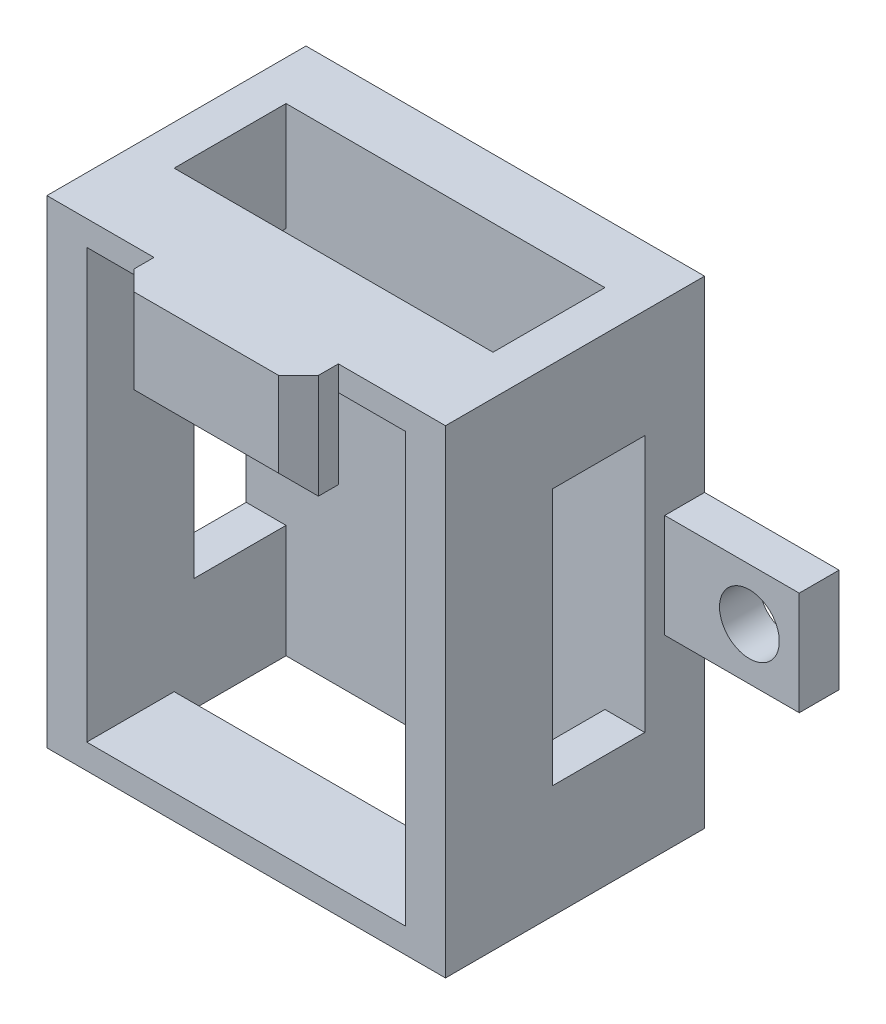
from build123d import *

# Parameters (mm, degrees)
SKETCH1_W           = 20
SKETCH1_H           = 24
BOSS_EXTRUDE1_DEPTH = 3
SKETCH2_W           = 20
SKETCH2_H           = 24
SKETCH2_W_2         = 16
SKETCH2_H_2         = 21.5
BOSS_EXTRUDE2_DEPTH = 10
SKETCH3_W           = 9.25
SKETCH3_H           = 5.25
BOSS_EXTRUDE3_DEPTH = 2
CHAMFER1_SIZE       = 1
SKETCH4_W           = 6.75
SKETCH4_H           = 5.2
SKETCH4_R           = 1.5
BOSS_EXTRUDE4_DEPTH = 2
SKETCH5_W           = 16
SKETCH5_H           = 5.615862193
CUT_EXTRUDE1_DEPTH  = 33.887117539
SKETCH6_W           = 4.619985453
SKETCH6_H           = 12.899576223
CUT_EXTRUDE4_DEPTH  = 33.932696519


with BuildPart() as part:
    # Sketch1 → Boss-Extrude1 (new body)
    with BuildSketch(Plane.XY):
        Rectangle(SKETCH1_W, SKETCH1_H)
    extrude(amount=BOSS_EXTRUDE1_DEPTH)

    # Sketch2 → Boss-Extrude2 (add)
    with BuildSketch(Plane.XY.offset(3)):
        Rectangle(SKETCH2_W, SKETCH2_H)
        Rectangle(SKETCH2_W_2, SKETCH2_H_2, mode=Mode.SUBTRACT)
    extrude(amount=BOSS_EXTRUDE2_DEPTH)

    # Sketch3 → Boss-Extrude3 (add)
    with BuildSketch(Plane.XY.offset(13)):
        with Locations((0, 9.375)):
            Rectangle(SKETCH3_W, SKETCH3_H)
    extrude(amount=BOSS_EXTRUDE3_DEPTH)

    # Chamfer1
    chamfer1_edges = [part.edges().sort_by_distance(p)[0] for p in [
        (-4.625, 9.375, 15),
        (0, 6.75, 15),
        (4.625, 9.375, 15),
    ]]
    chamfer(chamfer1_edges, length=CHAMFER1_SIZE)

    # Sketch4 → Boss-Extrude4 (add)
    # profile 1 of 2: a face of its own
    with BuildSketch(Plane(origin=(0, 0, 0), x_dir=(-1, 0, 0), z_dir=(0, 0, -1))):
        with Locations((-13.375, 0)):
            Rectangle(SKETCH4_W, SKETCH4_H)
        with Locations((-14.25, 0)):
            Circle(SKETCH4_R, mode=Mode.SUBTRACT)
    # profile 2 of 2: a face of its own
    with BuildSketch(Plane(origin=(0, 0, 0), x_dir=(-1, 0, 0), z_dir=(0, 0, -1))):
        with Locations((13.375, 0)):
            Rectangle(SKETCH4_W, SKETCH4_H)
        with Locations((14.25, 0)):
            Circle(SKETCH4_R, mode=Mode.SUBTRACT)
    extrude(amount=-BOSS_EXTRUDE4_DEPTH)

    # Sketch5 → Cut-Extrude1 (cut, through all)
    with BuildSketch(Plane(origin=(0, 12, 0), x_dir=(1, 0, 0), z_dir=(0, 1, 0))):
        with Locations((0, -5.807931096)):
            Rectangle(SKETCH5_W, SKETCH5_H)
    extrude(amount=-CUT_EXTRUDE1_DEPTH, mode=Mode.SUBTRACT)

    # Sketch6 → Cut-Extrude4 (cut, through all)
    with BuildSketch(Plane.ZY.offset(10)):
        with Locations((5.309992727, 0.119967863)):
            Rectangle(SKETCH6_W, SKETCH6_H)
    extrude(amount=-CUT_EXTRUDE4_DEPTH, mode=Mode.SUBTRACT)


solid = part.part
